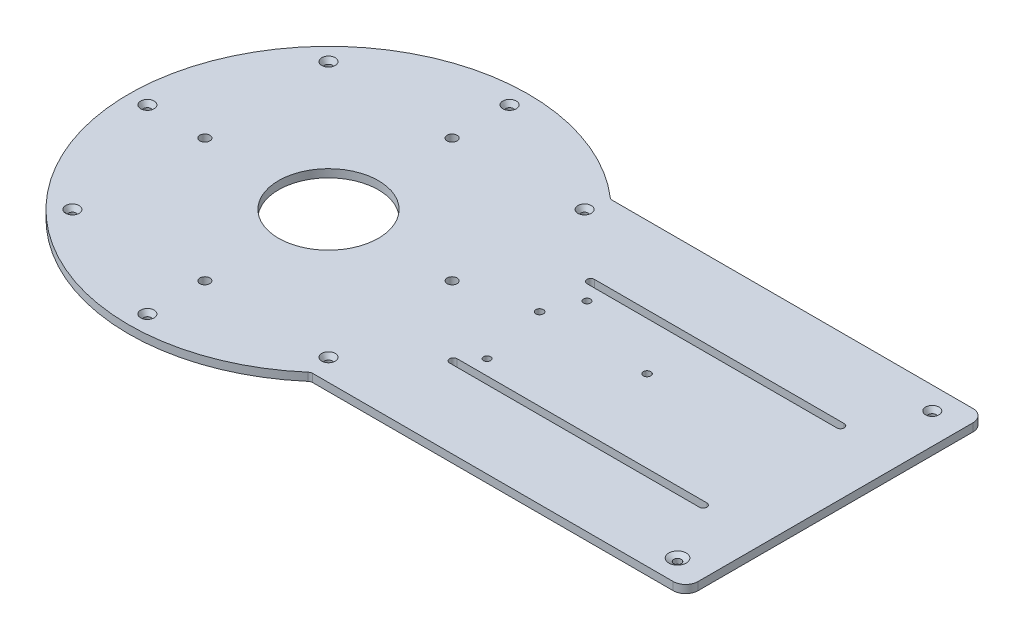
from build123d import *
from OCP.BRepFilletAPI import BRepFilletAPI_MakeChamfer

# Parameters (mm, degrees)
SKETCH1_R           = 20
SKETCH1_R_2         = 1.5
SKETCH1_R_3         = 2
SKETCH1_R_4         = 1.4
BOSS_EXTRUDE1_DEPTH = 3.2
CHAMFER1_SIZE       = 1.2
CHAMFER1_SIZE2      = 1.997135379


with BuildPart() as part:
    # Sketch1 → Boss-Extrude1 (new body)
    with BuildSketch(Plane(origin=(0, 0, 0), x_dir=(1, 0, 0), z_dir=(0, 1, 0))):
        with BuildLine():
            Line((283, 55), (283, -55))
            ThreePointArc((283, -55), (281.535533906, -58.535533906), (278, -60))
            Line((278, -60), (133.66563146, -60))
            ThreePointArc((133.66563146, -60), (132.967201164, -60.125914857), (132.35671362, -60.487804878))
            ThreePointArc((132.35671362, -60.487804878), (0, 0), (132.35671362, 60.487804878))
            ThreePointArc((132.35671362, 60.487804878), (132.967201164, 60.125914857), (133.66563146, 60))
            Line((133.66563146, 60), (278, 60))
            ThreePointArc((278, 60), (281.535533906, 58.535533906), (283, 55))
        make_face()
        with Locations(Location((80, 0, 0), (0, 0, 270))):
            Circle(SKETCH1_R, mode=Mode.SUBTRACT)
        with Locations(Location((7.5, 0, 0), (0, 0, 270))):
            Circle(SKETCH1_R_2, mode=Mode.SUBTRACT)
        with Locations(Location((28.734758364, 51.265241636, 0), (0, 0, 270))):
            Circle(SKETCH1_R_2, mode=Mode.SUBTRACT)
        with Locations(Location((80, 72.5, 0), (0, 0, 270))):
            Circle(SKETCH1_R_2, mode=Mode.SUBTRACT)
        with Locations(Location((131.265241636, 51.265241636, 0), (0, 0, 270))):
            Circle(SKETCH1_R_2, mode=Mode.SUBTRACT)
        with Locations(Location((131.265241636, -51.265241636, 0), (0, 0, 270))):
            Circle(SKETCH1_R_2, mode=Mode.SUBTRACT)
        with Locations(Location((80, -72.5, 0), (0, 0, 270))):
            Circle(SKETCH1_R_2, mode=Mode.SUBTRACT)
        with Locations(Location((28.734758364, -51.265241636, 0), (0, 0, 270))):
            Circle(SKETCH1_R_2, mode=Mode.SUBTRACT)
        with Locations(Location((30.5, 0, 0), (0, 0, 270))):
            Circle(SKETCH1_R_3, mode=Mode.SUBTRACT)
        with Locations(Location((270.75, 51, 0), (0, 0, 270))):
            Circle(SKETCH1_R_2, mode=Mode.SUBTRACT)
        with Locations(Location((270.75, -51, 0), (0, 0, 270))):
            Circle(SKETCH1_R_2, mode=Mode.SUBTRACT)
        with Locations(Location((163.5, 20, 0), (0, 0, 270))):
            Circle(SKETCH1_R_4, mode=Mode.SUBTRACT)
        with Locations(Location((163.5, -20, 0), (0, 0, 270))):
            Circle(SKETCH1_R_4, mode=Mode.SUBTRACT)
        with Locations(Location((157.75, 6.8, 0), (0, 0, 270))):
            Circle(SKETCH1_R_2, mode=Mode.SUBTRACT)
        with Locations(Location((200.75, 6.8, 0), (0, 0, 270))):
            Circle(SKETCH1_R_2, mode=Mode.SUBTRACT)
        with Locations(Location((80, 49.5, 0), (0, 0, 270))):
            Circle(SKETCH1_R_3, mode=Mode.SUBTRACT)
        with Locations(Location((129.5, 0, 0), (0, 0, 270))):
            Circle(SKETCH1_R_3, mode=Mode.SUBTRACT)
        with Locations(Location((80, -49.5, 0), (0, 0, 270))):
            Circle(SKETCH1_R_3, mode=Mode.SUBTRACT)
        with BuildLine():
            Line((157.5, -29), (257.5, -29))
            ThreePointArc((257.5, -29), (259, -27.5), (257.5, -26))
            Line((257.5, -26), (157.5, -26))
            ThreePointArc((157.5, -26), (156, -27.5), (157.5, -29))
        make_face(mode=Mode.SUBTRACT)
        with BuildLine():
            Line((257.5, 26), (157.5, 26))
            ThreePointArc((157.5, 26), (156, 27.5), (157.5, 29))
            Line((157.5, 29), (257.5, 29))
            ThreePointArc((257.5, 29), (259, 27.5), (257.5, 26))
        make_face(mode=Mode.SUBTRACT)
    extrude(amount=BOSS_EXTRUDE1_DEPTH)

    # Chamfer1: one chamfer whose edges measure the first distance from different faces: ONE call of the kernel's chamfer builder (chamfer() names one face for all edges)
    chamfer1_edges_1 = [part.edges().sort_by_distance(p)[0] for p in [
        (28.734758364, 3.2, -52.765241636),
        (80, 3.2, -74),
        (131.265241636, 3.2, -52.765241636),
        (131.265241636, 3.2, 49.765241636),
        (80, 3.2, 71),
        (28.734758364, 3.2, 49.765241636),
        (270.75, 3.2, -52.5),
        (7.5, 3.2, -1.5),
    ]]
    chamfer1_side_1 = [part.faces().sort_by_distance(p)[0] for p in [
        (141.32803895, 3.2, 0.002840635),
    ]]
    chamfer1_edges_2 = [part.edges().sort_by_distance(p)[0] for p in [
        (270.75, 3.2, 49.5),
    ]]
    chamfer1_side_2 = [part.faces().sort_by_distance(p)[0] for p in [
        (270.75, 1.6, 49.5),
    ]]
    chamfer1 = BRepFilletAPI_MakeChamfer(part.part.solid().wrapped)
    for e in chamfer1_edges_1:
        chamfer1.Add(CHAMFER1_SIZE, CHAMFER1_SIZE2, e.wrapped, chamfer1_side_1[0].wrapped)  # the first distance lies on this face
    for e in chamfer1_edges_2:
        chamfer1.Add(CHAMFER1_SIZE, CHAMFER1_SIZE2, e.wrapped, chamfer1_side_2[0].wrapped)  # the first distance lies on this face
    add(Compound.cast(chamfer1.Shape()), mode=Mode.REPLACE)


solid = part.part
